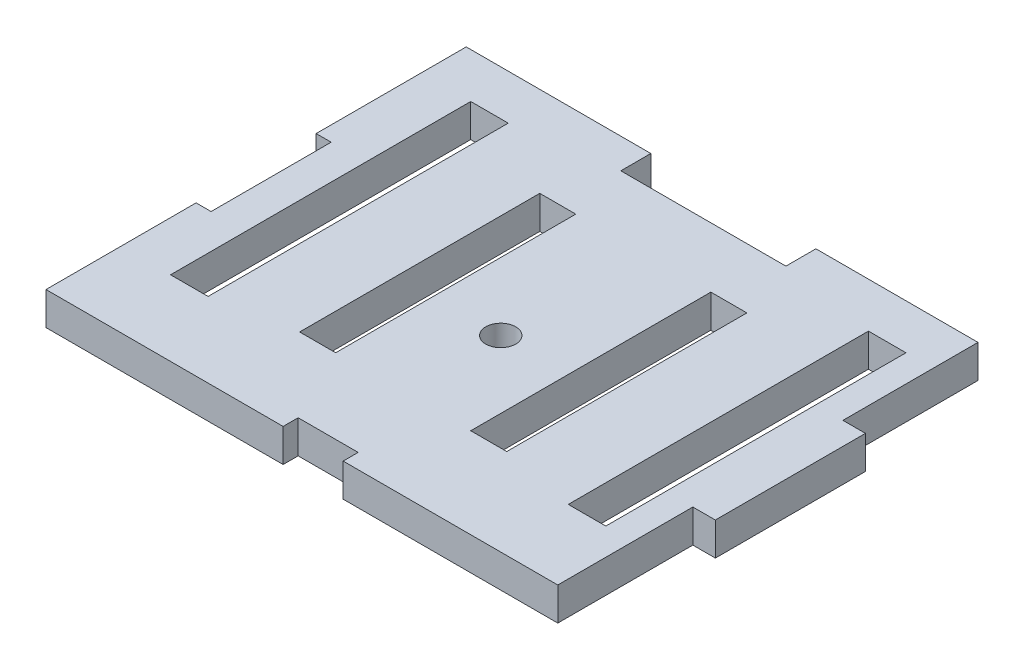
from build123d import *

# Parameters (mm, degrees)
SKETCH1_R           = 1
SKETCH1_W           = 2.5
SKETCH1_H           = 20
SKETCH1_W_2         = 2.4
SKETCH1_H_2         = 16
BOSS_EXTRUDE1_DEPTH = 2.2


with BuildPart() as part:
    # Sketch1 → Boss-Extrude1 (new body)
    with BuildSketch(Plane(origin=(0, 0, 0), x_dir=(1, 0, 0), z_dir=(0, 1, 0))):
        Polygon((-117.859054558, 127.025957199), (-107.059054558, 127.025957199), (-107.059054558, 118.025957199), (-105.559054558, 118.025957199), (-105.559054558, 108.025957199), (-107.059054558, 108.025957199), (-107.059054558, 99.025957199), (-121.359054558, 99.025957199), (-121.359054558, 100.025957199), (-125.359054558, 100.025957199), (-125.359054558, 99.025957199), (-141.159054558, 99.025957199), (-141.159054558, 109.025957199), (-140.159054558, 109.025957199), (-140.159054558, 117.025957199), (-141.159054558, 117.025957199), (-141.159054558, 127.025957199), (-128.859054558, 127.025957199), (-128.859054558, 125.025957199), (-117.859054558, 125.025957199), align=None)
        with Locations(Location((-123.359054558, 111.525957199, 0), (0, 0, 270))):
            Circle(SKETCH1_R, mode=Mode.SUBTRACT)
        with Locations((-110.109054558, 114.025957199)):
            Rectangle(SKETCH1_W, SKETCH1_H, mode=Mode.SUBTRACT)
        with Locations((-136.609054558, 114.025957199)):
            Rectangle(SKETCH1_W, SKETCH1_H, mode=Mode.SUBTRACT)
        with Locations((-129.059054558, 113.025957199)):
            Rectangle(SKETCH1_W_2, SKETCH1_H_2, mode=Mode.SUBTRACT)
        with Locations((-117.659054558, 113.025957199)):
            Rectangle(SKETCH1_W_2, SKETCH1_H_2, mode=Mode.SUBTRACT)
    extrude(amount=BOSS_EXTRUDE1_DEPTH)


solid = part.part
